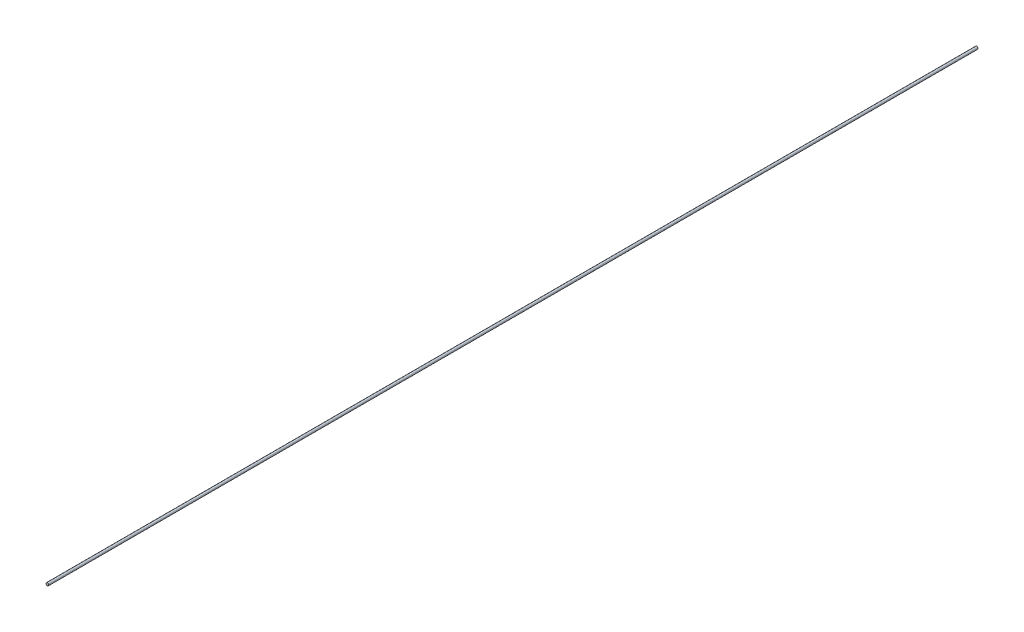
from build123d import *

# Parameters (mm, degrees)
SKETCH1_W = 1.27
SKETCH1_H = 889


with BuildPart() as part:
    # Sketch1 → Revolve-Thin1 (revolve)
    with BuildSketch(Plane(origin=(0, 0, 0), x_dir=(1, 0, 0), z_dir=(0, 1, 0)), mode=Mode.PRIVATE) as revolve_thin1_sk:
        with Locations((-2.378791677, 357.943903032)):
            Rectangle(SKETCH1_W, SKETCH1_H)
    revolve(revolve_thin1_sk.sketch.rotate(Axis((-3.013791677, 0, -802.443903032), (0, 0, 1)), 180), axis=Axis((-3.013791677, 0, -802.443903032), (0, 0, 1)))


solid = part.part
